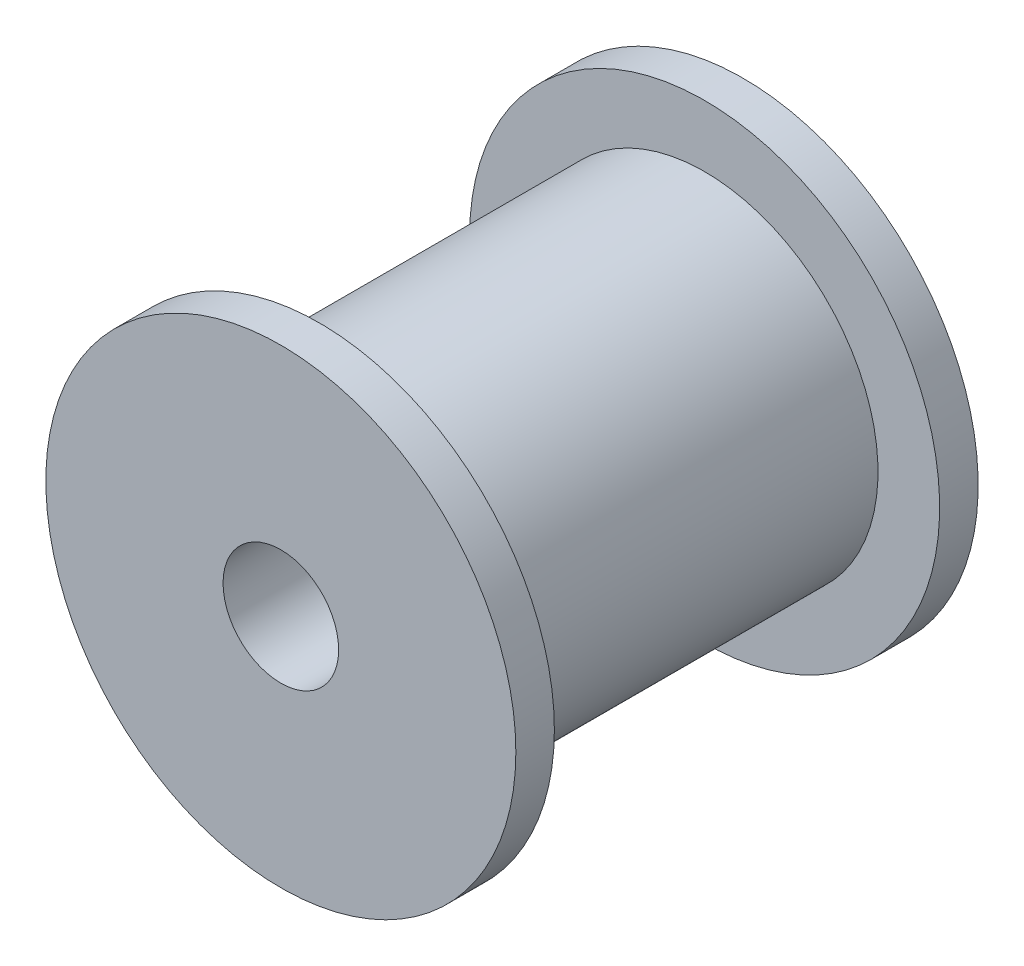
from build123d import *
from build123d.topology import SkipClean

# Parameters (mm, degrees)
ESQUISSE1_R        = 6.1
ESQUISSE1_R_2      = 1.5
BOSS_EXTRU_1_DEPTH = 1
BOSS_EXTRU_2_START = 10
ESQUISSE2_R        = 4.5
ESQUISSE2_R_2      = 1.5
BOSS_EXTRU_2_DEPTH = 10
BOSS_EXTRU_3_START = 1
ESQUISSE3_R        = 6.1
ESQUISSE3_R_2      = 1.5
BOSS_EXTRU_3_DEPTH = 1


with BuildPart() as part:
    # Esquisse1 → Boss.-Extru.1 (new body)
    with BuildSketch(Plane.XY):
        Circle(ESQUISSE1_R)
        Circle(ESQUISSE1_R_2, mode=Mode.SUBTRACT)
    extrude(amount=BOSS_EXTRU_1_DEPTH)

    # Esquisse2 → Boss.-Extru.2 (add)
    with SkipClean():  # the faces are left unmerged after this step: merging them gives an invalid solid
        with BuildSketch(Plane(origin=(0, 0, 0), x_dir=(-1, 0, 0), z_dir=(0, 0, -1)).offset(BOSS_EXTRU_2_START)):
            Circle(ESQUISSE2_R)
            Circle(ESQUISSE2_R_2, mode=Mode.SUBTRACT)
        extrude(amount=-BOSS_EXTRU_2_DEPTH)

    # Esquisse3 → Boss.-Extru.3 (add)
    with SkipClean():  # the faces are left unmerged after this step: merging them gives an invalid solid
        with BuildSketch(Plane(origin=(0, 0, -10), x_dir=(-1, 0, 0), z_dir=(0, 0, -1)).offset(BOSS_EXTRU_3_START)):
            with Locations(Location((0, 0, 0), (0, 0, 180))):
                Circle(ESQUISSE3_R)
            Circle(ESQUISSE3_R_2, mode=Mode.SUBTRACT)
        extrude(amount=-BOSS_EXTRU_3_DEPTH)


solid = part.part
